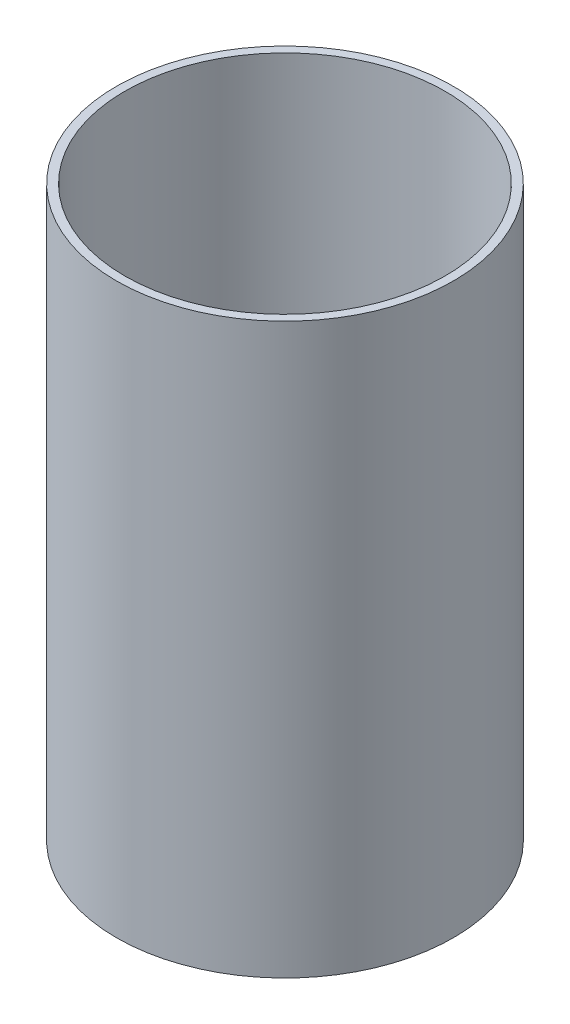
from build123d import *

# Parameters (mm, degrees)
SKETCH1_R           = 40
SKETCH1_R_2         = 38
BOSS_EXTRUDE1_DEPTH = 135


with BuildPart() as part:
    # Sketch1 → Boss-Extrude1 (new body)
    with BuildSketch(Plane(origin=(0, 0, 0), x_dir=(1, 0, 0), z_dir=(0, 1, 0))):
        with Locations(Location((0, 0, 0), (0, 0, 270))):
            Circle(SKETCH1_R)
        with Locations(Location((0, 0, 0), (0, 0, 270))):
            Circle(SKETCH1_R_2, mode=Mode.SUBTRACT)
    extrude(amount=BOSS_EXTRUDE1_DEPTH)


solid = part.part
